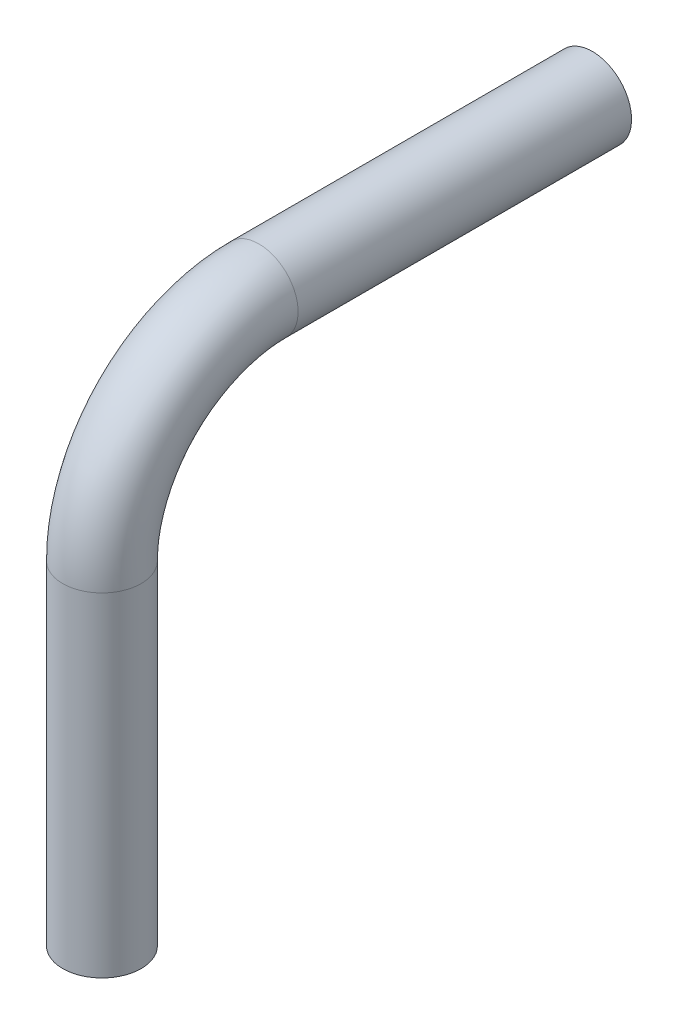
from build123d import *

# Parameters (mm, degrees)
SKETCH_2_R = 0.4


with BuildPart() as part:
    # По траектории1: sweep along a path in Эскиз1
    with BuildLine(Plane(origin=(0, 0, 0), x_dir=(0, 0, -1), z_dir=(1, 0, 0))) as sweep_1_path:
        Line((5, 0), (1.6, 0))
        ThreePointArc((1.6, 0), (0.46862915, -0.46862915), (0, -1.6))
        Line((0, -1.6), (0, -5))
    # Эскиз2 → По траектории1 (sweep)
    with BuildSketch(Plane(origin=(0, 0, -5), x_dir=(-1, 0, 0), z_dir=(0, 0, -1))):
        Circle(SKETCH_2_R)
    sweep(path=sweep_1_path.line)


solid = part.part
